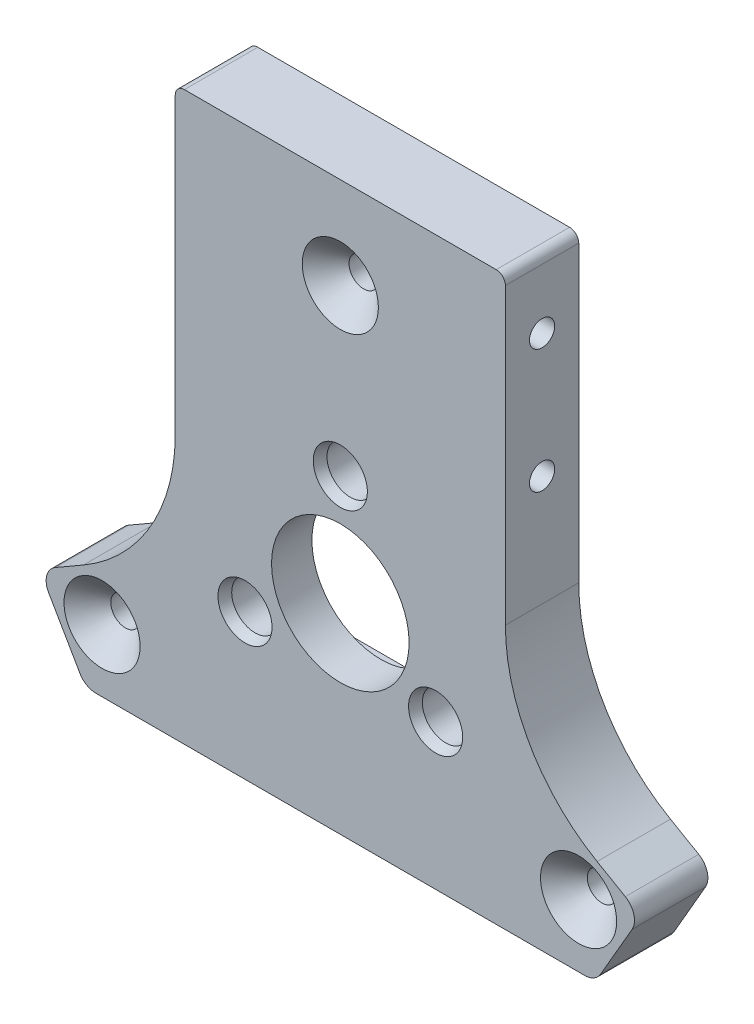
from build123d import *

# Parameters (mm, degrees)
SKETCH2_R                                       = 7.5
BOSS_EXTRUDE1_DEPTH                             = 8
CSK_FOR_M3_FLAT_HEAD_MACHINE_SCREW2_D           = 3.2
CSK_FOR_M3_FLAT_HEAD_MACHINE_SCREW2_CSINK_D     = 8.3
CSK_FOR_M3_FLAT_HEAD_MACHINE_SCREW2_CSINK_ANGLE = 90
FILLET1_R                                       = 20
V_GROOVE_CUTOUT_FLIPPED_DEPTH                   = 3.6
SKETCH49_R                                      = 2.55
CUT_EXTRUDE3_DEPTH                              = 52.922196079
CHAMFER2_SIZE                                   = 0.4
CHAMFER2_SIZE2                                  = 1.098990968
MOVE_FACE2_BY                                   = 0.5
MOVE_FACE2_2_BY                                 = 0.5
MOVE_FACE2_3_BY                                 = 0.5
MOVE_FACE2_4_BY                                 = 0.5
MOVE_FACE2_5_BY                                 = 0.5
MOVE_FACE2_6_BY                                 = 0.5
CIRPATTERN2_COUNT                               = 3
SKETCH20_R                                      = 1.375
TOOL_WING_SCREW_HOLES_DEPTH                     = 4
FILLET17_R                                      = 2
FILLET18_R                                      = 1


with BuildPart() as part:
    # Sketch2 → Boss-Extrude1 (new body)
    with BuildSketch(Plane.XY):
        Polygon((-18, 40), (18, 40), (18, -4.618802154), (32.810889132, -13.169872981), (27.810889132, -21.830127019), (-27.810889132, -21.830127019), (-32.810889132, -13.169872981), (-18, -4.618802154), align=None)
        Circle(SKETCH2_R, mode=Mode.SUBTRACT)
    extrude(amount=BOSS_EXTRUDE1_DEPTH)

    # CSK for M3 Flat Head Machine Screw2 (through all)
    with Locations(Plane.XY.offset(8)):
        with Locations((-25.980762114, -15), (0, 30), (25.980762114, -15)):
            CounterSinkHole(CSK_FOR_M3_FLAT_HEAD_MACHINE_SCREW2_D / 2, CSK_FOR_M3_FLAT_HEAD_MACHINE_SCREW2_CSINK_D / 2, counter_sink_angle=CSK_FOR_M3_FLAT_HEAD_MACHINE_SCREW2_CSINK_ANGLE)

    # Fillet1
    fillet1_edges = [part.edges().sort_by_distance(p)[0] for p in [
        (18, -4.618802154, 4),
        (-18, -4.618802154, 4),
    ]]
    fillet(fillet1_edges, radius=FILLET1_R)

    # Sketch47 → v-groove cutout flipped (cut)
    with BuildSketch(Plane(origin=(0, 0, 0), x_dir=(-1, 0, 0), z_dir=(0, 0, -1))):
        with BuildLine():
            Line((-3.464101615, 14), (-13.856406461, -4))
            ThreePointArc((-13.856406461, -4), (-13.856406461, -8), (-10.392304845, -10))
            Line((-10.392304845, -10), (10.392304845, -10))
            ThreePointArc((10.392304845, -10), (13.856406461, -8), (13.856406461, -4))
            Line((13.856406461, -4), (3.464101615, 14))
            ThreePointArc((3.464101615, 14), (0, 16), (-3.464101615, 14))
        make_face()
    extrude(amount=-V_GROOVE_CUTOUT_FLIPPED_DEPTH, mode=Mode.SUBTRACT)

    # Sketch49 → Cut-Extrude3 (cut, through all)
    with BuildSketch(Plane(origin=(0, 0, 3.6), x_dir=(-1, 0, 0), z_dir=(0, 0, -1))):
        with Locations((0, 12)):
            Circle(SKETCH49_R)
        with Locations((10.392304845, -6)):
            Circle(SKETCH49_R)
        with Locations((-10.392304845, -6)):
            Circle(SKETCH49_R)
    extrude(amount=-CUT_EXTRUDE3_DEPTH, mode=Mode.SUBTRACT)

    # Chamfer2
    chamfer2_edges = [part.edges().sort_by_distance(p)[0] for p in [
        (2.55, 12, 8),
        (-7.842304845, -6, 8),
        (12.942304845, -6, 8),
    ]]
    chamfer2_side = [part.faces().sort_by_distance(p)[0] for p in [
        (17.098380214, 23.464101615, 8),
    ]]
    chamfer(chamfer2_edges, length=CHAMFER2_SIZE, length2=CHAMFER2_SIZE2, reference=chamfer2_side[0])

    # Move Face2: a curved face moved inward by 0.5
    add(Solid.thicken(part.faces().sort_by_distance((-13.856406461, -8, 1.8))[0], -MOVE_FACE2_BY), mode=Mode.SUBTRACT)

    # Move Face2 2: a face moved inward by 0.5
    extrude(part.faces().sort_by_distance((0, -10, 1.8))[0], amount=MOVE_FACE2_2_BY, dir=(0, -1, 0), mode=Mode.SUBTRACT)

    # Move Face2 3: a curved face moved inward by 0.5
    add(Solid.thicken(part.faces().sort_by_distance((13.856406461, -8, 1.8))[0], -MOVE_FACE2_3_BY), mode=Mode.SUBTRACT)

    # Move Face2 4: a face moved inward by 0.5
    extrude(part.faces().sort_by_distance((8.660254038, 5, 1.8))[0], amount=MOVE_FACE2_4_BY, dir=(0.866025404, 0.5, 0), mode=Mode.SUBTRACT)

    # Move Face2 5: a curved face moved inward by 0.5
    add(Solid.thicken(part.faces().sort_by_distance((0, 16, 1.8))[0], -MOVE_FACE2_5_BY), mode=Mode.SUBTRACT)

    # Move Face2 6: a face moved inward by 0.5
    extrude(part.faces().sort_by_distance((-8.660254038, 5, 1.8))[0], amount=MOVE_FACE2_6_BY, dir=(-0.866025404, 0.5, 0), mode=Mode.SUBTRACT)

    # Sketch46 → tool ball cutout (revolve, cut)
    with BuildSketch(Plane(origin=(0, 30, 0), x_dir=(1, 0, 0), z_dir=(0, 1, 0))):
        with BuildLine():
            Line((0, 4.3), (0, -3.7))
            ThreePointArc((0, -3.7), (-4, 0.3), (0, 4.3))
        make_face()
    tool_ball_cutout = revolve(axis=Axis((0, 30, 0), (0, 0, -1)), mode=Mode.SUBTRACT)

    # CirPattern2: tool ball cutout ×3 about axis
    cirpattern2_axis = Axis((0, 0, 0), (0, 0, 1))
    for i in range(1, CIRPATTERN2_COUNT):
        add(tool_ball_cutout.rotate(cirpattern2_axis, i * 360 / CIRPATTERN2_COUNT), mode=Mode.SUBTRACT)

    # Sketch20 → Tool Wing Screw Holes (cut)
    with BuildSketch(Plane(origin=(18, 0, 0), x_dir=(0, 0, -1), z_dir=(1, 0, 0))):
        with Locations(Location((-4, 19, 0), (0, 0, 90))):
            Circle(SKETCH20_R)
        with Locations(Location((-4, 32.5, 0), (0, 0, 90))):
            Circle(SKETCH20_R)
    tool_wing_screw_holes = extrude(amount=-TOOL_WING_SCREW_HOLES_DEPTH, mode=Mode.SUBTRACT)

    # Mirror2: Tool Wing Screw Holes across plane
    add(tool_wing_screw_holes.mirror(Plane(origin=(0, 0, 0), x_dir=(0, 0, 1), z_dir=(1, 0, 0))), mode=Mode.SUBTRACT)

    # Fillet17
    fillet17_edges = [part.edges().sort_by_distance(p)[0] for p in [
        (32.810889132, -13.169872981, 4),
        (27.810889132, -21.830127019, 4),
        (-27.810889132, -21.830127019, 4),
        (-32.810889132, -13.169872981, 4),
    ]]
    fillet(fillet17_edges, radius=FILLET17_R)

    # Fillet18
    fillet18_edges = [part.edges().sort_by_distance(p)[0] for p in [
        (-18, 40, 4),
        (18, 40, 4),
    ]]
    fillet(fillet18_edges, radius=FILLET18_R)


solid = part.part
